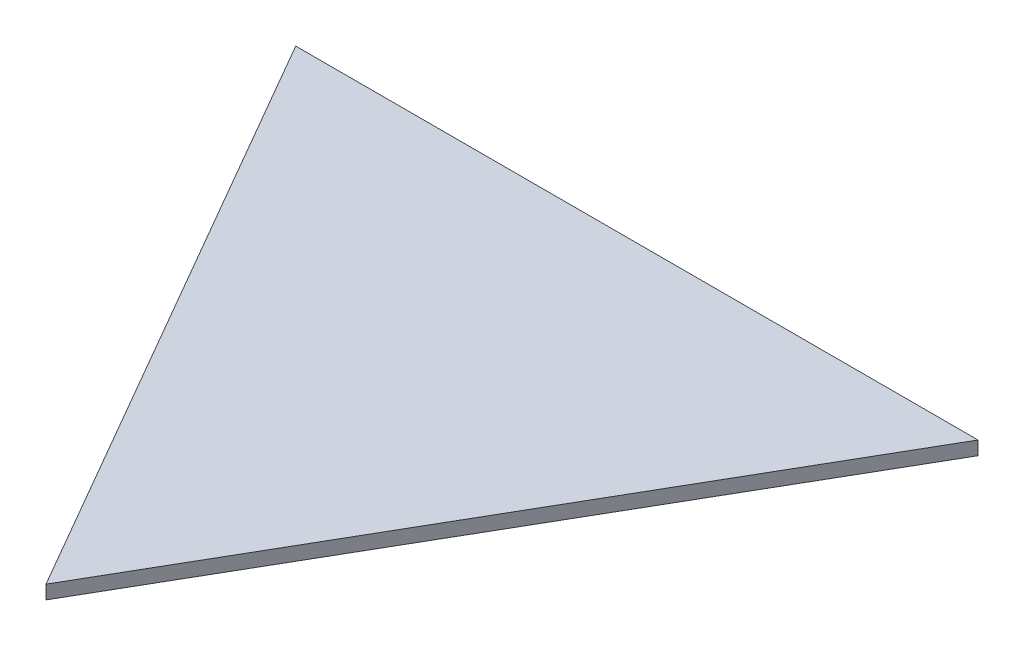
from build123d import *

# Parameters (mm, degrees)
BOSS_EXTRUDE1_DEPTH = 10


with BuildPart() as part:
    # Sketch1 → Boss-Extrude1 (new body)
    with BuildSketch(Plane(origin=(0, 0, 0), x_dir=(1, 0, 0), z_dir=(0, 1, 0))):
        Polygon((0, 0), (-250, 433.012701892), (250, 433.012701892), align=None)
    extrude(amount=BOSS_EXTRUDE1_DEPTH)


solid = part.part
